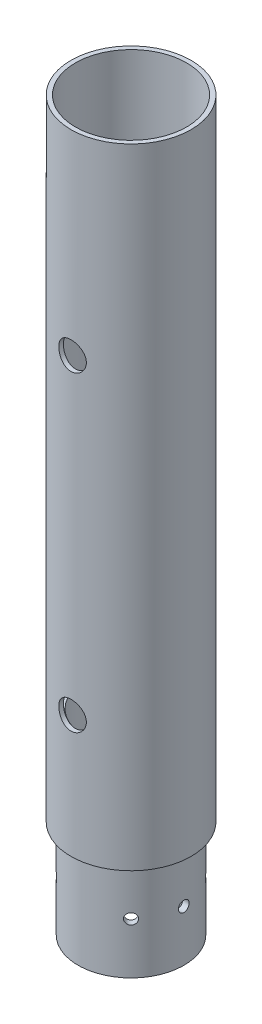
from build123d import *

# Parameters (mm, degrees)
SKETCH_1_R          = 135
SKETCH_1_R_2        = 125
EXTRUDE_1_DEPTH     = 1195
EXTRUDE_START       = 220
SKETCH_10_R         = 135
SKETCH_10_R_2       = 105
EXTRUDE_2_DEPTH     = 220
SKETCH_11_R         = 119
SKETCH_11_R_2       = 105
EXTRUDE_3_DEPTH     = 220
SKETCH_4_R          = 31
CUT_EXTRUDE_1_DEPTH = 1360.954043341
SKETCH_7_R          = 12
CUT_EXTRUDE_3_DEPTH = 1314.192674512
SKETCH_8_R          = 12
CUT_EXTRUDE_4_DEPTH = 1314.192674512
SKETCH_9_R          = 12
CUT_EXTRUDE_5_DEPTH = 1360.954043486


with BuildPart() as part:
    # 草图1 → 凸台-拉伸1 (new body)
    with BuildSketch(Plane(origin=(0, 0, 0), x_dir=(1, 0, 0), z_dir=(0, 1, 0))):
        Circle(SKETCH_1_R)
        Circle(SKETCH_1_R_2, mode=Mode.SUBTRACT)
    extrude(amount=EXTRUDE_1_DEPTH)

    # 草图10 → 凸台-拉伸2 (add)
    with BuildSketch(Plane(origin=(0, 0, 0), x_dir=(-1, 0, 0), z_dir=(0, -1, 0)).offset(EXTRUDE_START)):
        Circle(SKETCH_10_R)
        Circle(SKETCH_10_R_2, mode=Mode.SUBTRACT)
    extrude(amount=-EXTRUDE_2_DEPTH)

    # 草图11 → 凸台-拉伸3 (add)
    with BuildSketch(Plane.XZ.offset(220).offset(EXTRUDE_START)):
        Circle(SKETCH_11_R)
        Circle(SKETCH_11_R_2, mode=Mode.SUBTRACT)
    extrude(amount=-EXTRUDE_3_DEPTH)

    # 草图4 → 切除-拉伸1 (cut, through all)
    with BuildSketch(Plane.XY.offset(500)):
        with Locations((0, 755)):
            Circle(SKETCH_4_R)
        with Locations((0, 55)):
            Circle(SKETCH_4_R)
    extrude(amount=-CUT_EXTRUDE_1_DEPTH, mode=Mode.SUBTRACT)

    # 草图7 → 切除-拉伸3 (cut, through all)
    with BuildSketch(Plane(origin=(-250, 0, 250), x_dir=(-0.7071067811865476, 0, -0.7071067811865476), z_dir=(0.7071067811865476, 0, -0.7071067811865476))):
        with Locations((0, -325)):
            Circle(SKETCH_7_R)
    extrude(amount=CUT_EXTRUDE_3_DEPTH, mode=Mode.SUBTRACT)

    # 草图8 → 切除-拉伸4 (cut, through all)
    with BuildSketch(Plane(origin=(250, 0, 250), x_dir=(0.7071067811865476, 0, -0.7071067811865476), z_dir=(0.7071067811865476, 0, 0.7071067811865476))):
        with Locations((0, -325)):
            Circle(SKETCH_8_R)
    extrude(amount=-CUT_EXTRUDE_4_DEPTH, mode=Mode.SUBTRACT)

    # 草图9 → 切除-拉伸5 (cut, through all)
    with BuildSketch(Plane(origin=(500, 0, 0), x_dir=(0, 0, -1), z_dir=(1, 0, 0))):
        with Locations((0, -325)):
            Circle(SKETCH_9_R)
    extrude(amount=-CUT_EXTRUDE_5_DEPTH, mode=Mode.SUBTRACT)


solid = part.part
